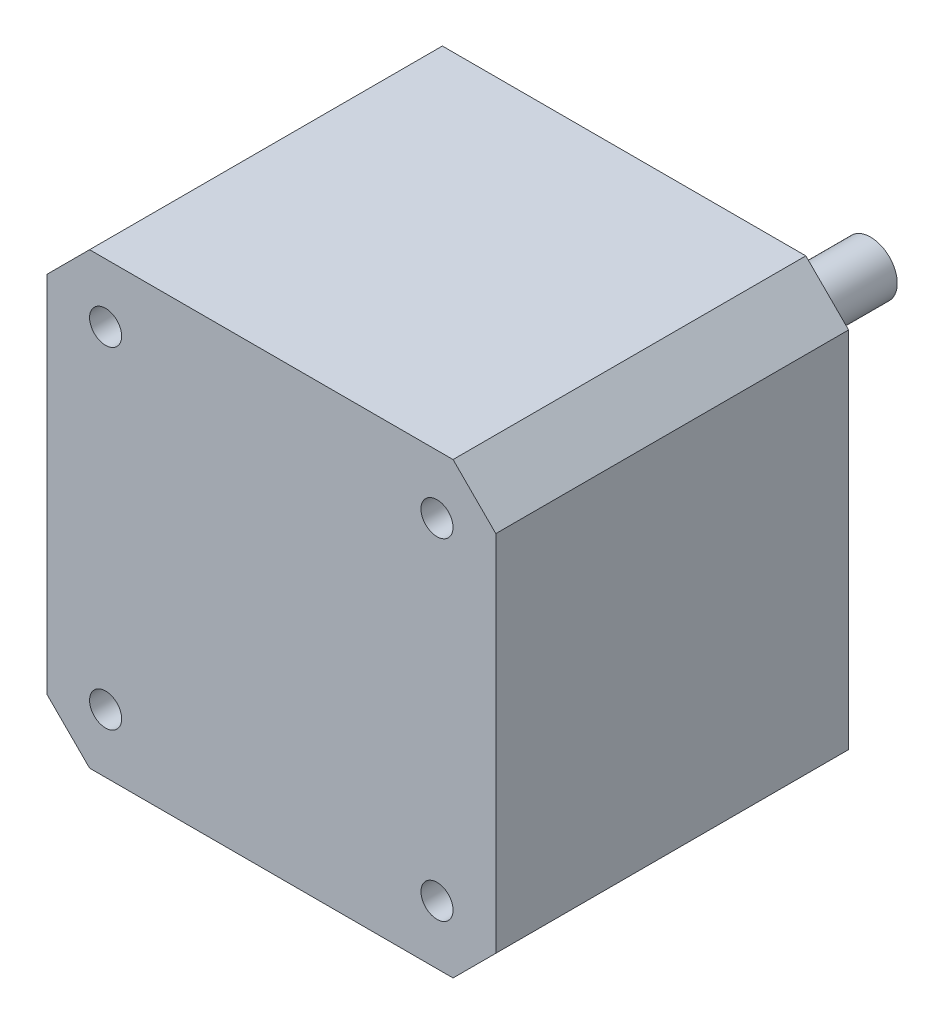
from build123d import *

# Parameters (mm, degrees)
SZKIC1_W                    = 42
SZKIC1_H                    = 42
DODANIE_WYCI_GNI_CIE1_DEPTH = 33
SFAZOWANIE1_SIZE            = 4
SZKIC2_R                    = 11
DODANIE_WYCI_GNI_CIE2_DEPTH = 1.3
SZKIC3_R                    = 2.5
DODANIE_WYCI_GNI_CIE3_DEPTH = 21.75
SZKIC4_R                    = 1.5
WYTNIJ_WYCI_GNI_CIE1_DEPTH  = 45.395945761


with BuildPart() as part:
    # Szkic1 → Dodanie-wyciągnięcie1 (new body)
    with BuildSketch(Plane.XY):
        Rectangle(SZKIC1_W, SZKIC1_H)
    extrude(amount=DODANIE_WYCI_GNI_CIE1_DEPTH)

    # Sfazowanie1
    sfazowanie1_edges = [part.edges().sort_by_distance(p)[0] for p in [
        (21, -21, 16.5),
        (-21, -21, 16.5),
        (-21, 21, 16.5),
        (21, 21, 16.5),
    ]]
    chamfer(sfazowanie1_edges, length=SFAZOWANIE1_SIZE)

    # Szkic2 → Dodanie-wyciągnięcie2 (add)
    with BuildSketch(Plane(origin=(0, 0, 0), x_dir=(-1, 0, 0), z_dir=(0, 0, -1))):
        Circle(SZKIC2_R)
    extrude(amount=DODANIE_WYCI_GNI_CIE2_DEPTH)

    # Szkic3 → Dodanie-wyciągnięcie3 (add)
    with BuildSketch(Plane(origin=(0, 0, -1.3), x_dir=(-1, 0, 0), z_dir=(0, 0, -1))):
        Circle(SZKIC3_R)
    extrude(amount=DODANIE_WYCI_GNI_CIE3_DEPTH)

    # Szkic4 → Wytnij-wyciągnięcie1 (cut, through all)
    with BuildSketch(Plane(origin=(0, 0, 0), x_dir=(-1, 0, 0), z_dir=(0, 0, -1))):
        with Locations((15.5, 15.5)):
            Circle(SZKIC4_R)
        with Locations(Location((-15.5, 15.5, 0), (0, 0, 180))):
            Circle(SZKIC4_R)
        with Locations((-15.5, -15.5)):
            Circle(SZKIC4_R)
        with Locations(Location((15.5, -15.5, 0), (0, 0, 180))):
            Circle(SZKIC4_R)
    extrude(amount=-WYTNIJ_WYCI_GNI_CIE1_DEPTH, mode=Mode.SUBTRACT)


solid = part.part
